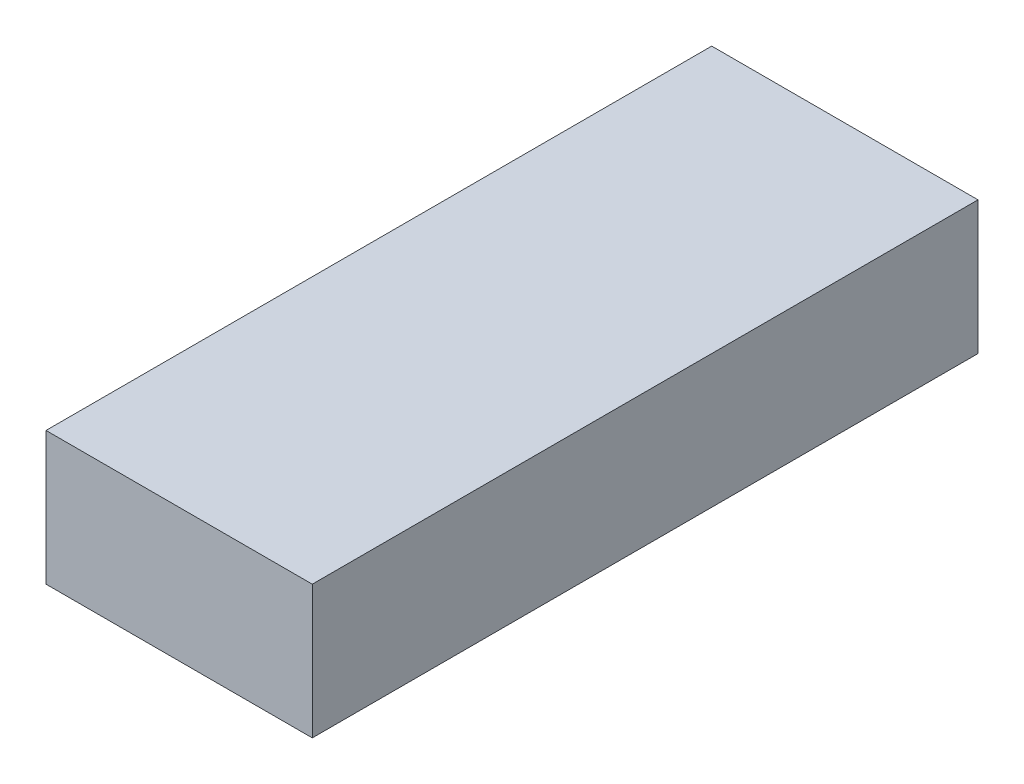
from build123d import *

# Parameters (mm, degrees)
SKETCH_1_W      = 20
SKETCH_1_H      = 50
EXTRUDE_1_DEPTH = 10


with BuildPart() as part:
    # 草图1 → 凸台-拉伸1 (new body)
    with BuildSketch(Plane(origin=(0, 0, 0), x_dir=(1, 0, 0), z_dir=(0, 1, 0))):
        with Locations((10, 25)):
            Rectangle(SKETCH_1_W, SKETCH_1_H)
    extrude(amount=EXTRUDE_1_DEPTH)


solid = part.part
